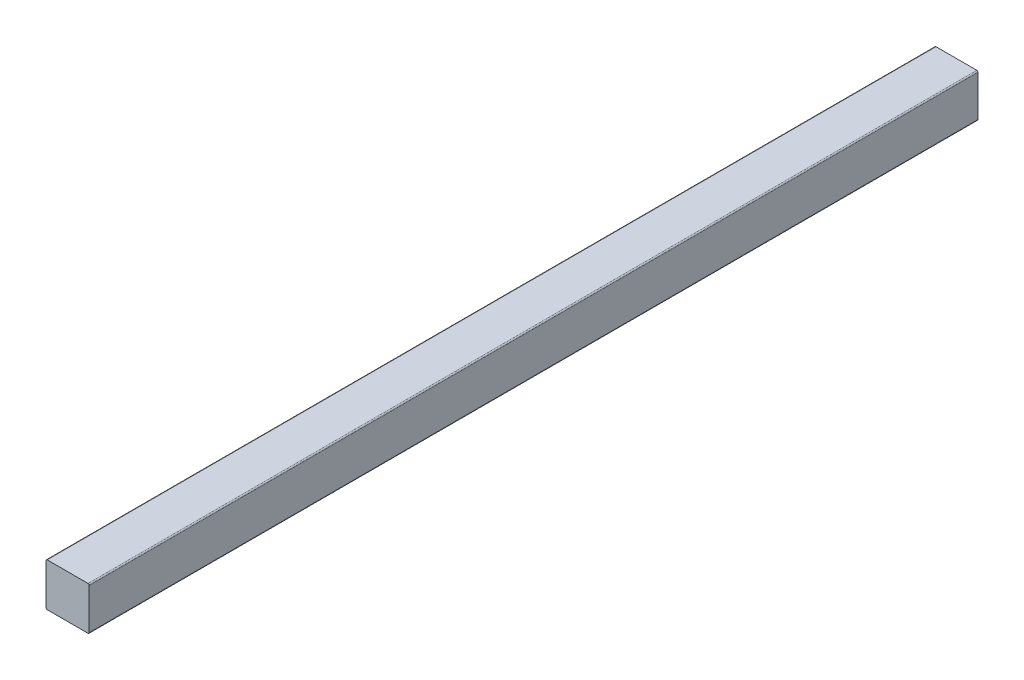
from build123d import *

# Parameters (mm, degrees)
BOSS_EXTRUDE1_DEPTH = 914.4


with BuildPart() as part:
    # Sketch1 → Boss-Extrude1 (new, symmetric)
    with BuildSketch(Plane.XY):
        with BuildLine():
            Line((-41.91, 44.45), (41.91, 44.45))
            ThreePointArc((41.91, 44.45), (43.706051224, 43.706051224), (44.45, 41.91))
            Line((44.45, 41.91), (44.45, -41.91))
            ThreePointArc((44.45, -41.91), (43.706051224, -43.706051224), (41.91, -44.45))
            Line((41.91, -44.45), (-41.91, -44.45))
            ThreePointArc((-41.91, -44.45), (-43.706051224, -43.706051224), (-44.45, -41.91))
            Line((-44.45, -41.91), (-44.45, 41.91))
            ThreePointArc((-44.45, 41.91), (-43.706051224, 43.706051224), (-41.91, 44.45))
        make_face()
    extrude(amount=BOSS_EXTRUDE1_DEPTH, both=True)


solid = part.part
